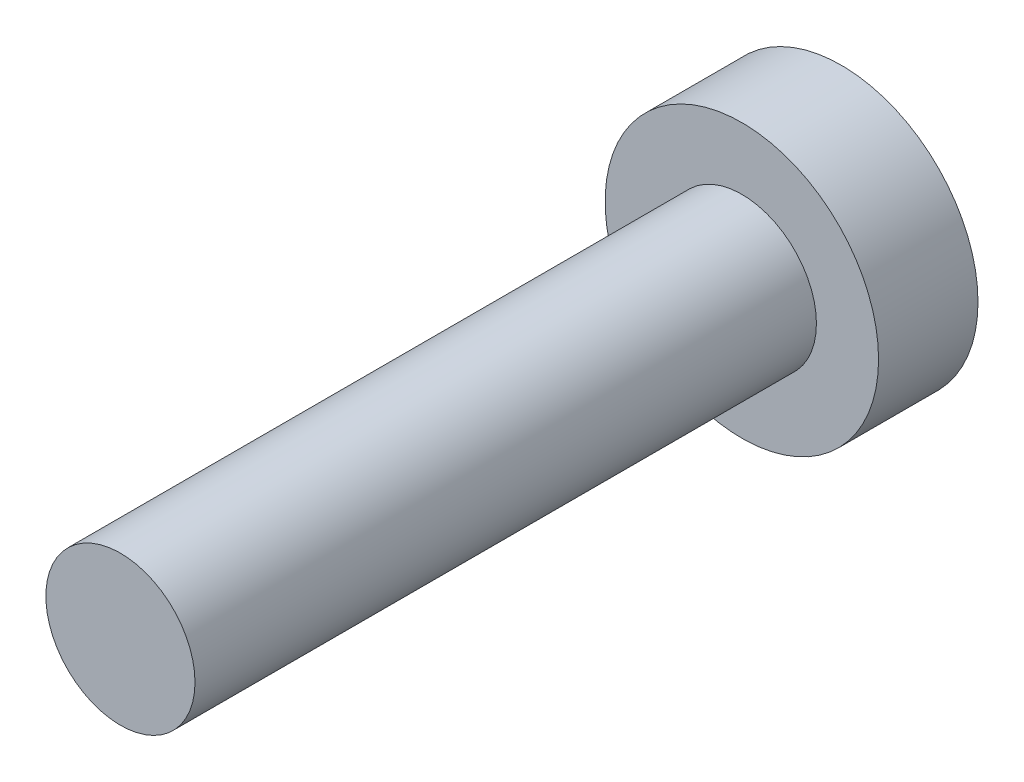
from build123d import *

# Parameters (mm, degrees)
SMOOTH_EYELET_SHOULDER_SKETCH_R = 1.5
SMOOTH_EYELET_SHOULDER_DEPTH    = 12.5
PIN_HEAD_SKETCH_R               = 2.75
PIN_HEAD_DEPTH                  = 2


with BuildPart() as part:
    # Smooth eyelet shoulder sketch → Smooth eyelet shoulder (new body)
    with BuildSketch(Plane.XY.offset(9)):
        with Locations((35.708348754, -12)):
            Circle(SMOOTH_EYELET_SHOULDER_SKETCH_R)
    extrude(amount=SMOOTH_EYELET_SHOULDER_DEPTH)

    # Pin head sketch → Pin head (add)
    with BuildSketch(Plane.XY.offset(7)):
        with Locations((35.708348754, -12)):
            Circle(PIN_HEAD_SKETCH_R)
    extrude(amount=PIN_HEAD_DEPTH)


solid = part.part
